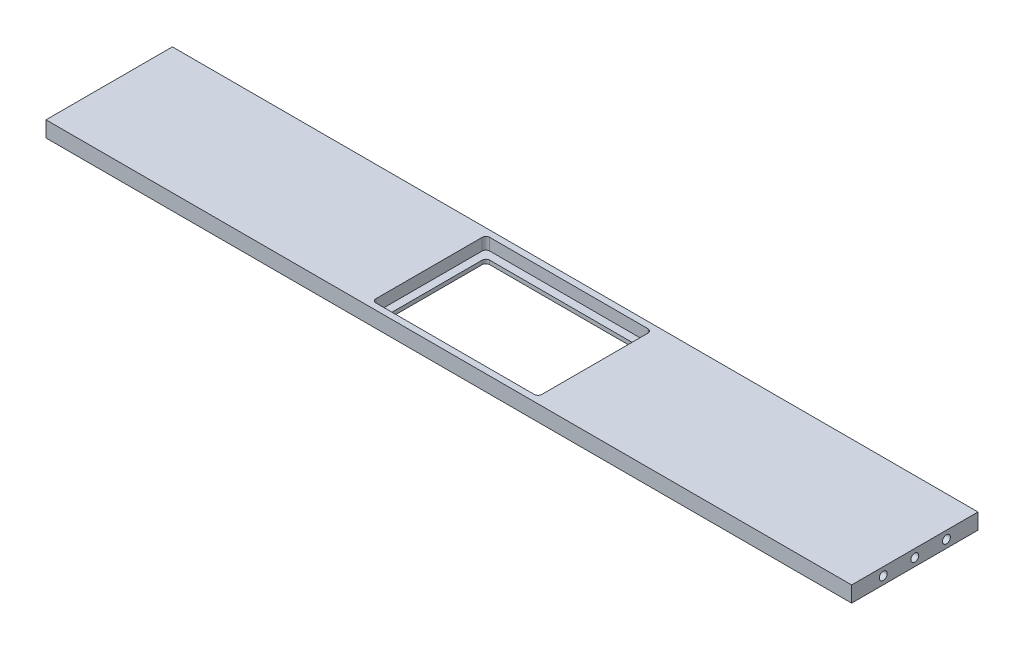
from build123d import *

# Parameters (mm, degrees)
SKETCH2_W                         = 647.7
SKETCH2_H                         = 12.7
BOSS_EXTRUDE1_DEPTH               = 50.8
CUT_EXTRUDE1_DEPTH                = 9.525
F_1_4_20_THREADED_HOLE_AT_2_COUNT = 2
F_1_4_20_THREADED_HOLE_AT_2_PITCH = 25.4
F_1_4_20_THREADED_HOLE_AT_3_COUNT = 2
F_1_4_20_THREADED_HOLE_AT_3_PITCH = 50.8
CUT_EXTRUDE2_DEPTH                = 329.056020368


with BuildPart() as part:
    # Sketch2 → Boss-Extrude1 (new, symmetric)
    with BuildSketch(Plane.XY):
        with Locations((0, -6.35)):
            Rectangle(SKETCH2_W, SKETCH2_H)
    extrude(amount=BOSS_EXTRUDE1_DEPTH, both=True)

    # Sketch3 → Cut-Extrude1 (cut)
    with BuildSketch(Plane(origin=(0, 0, 0), x_dir=(1, 0, 0), z_dir=(0, 1, 0))):
        with BuildLine():
            Line((63.675, 45.72), (-63.675, 45.72))
            ThreePointArc((-63.675, 45.72), (-65.796320344, 44.841320344), (-66.675, 42.72))
            Line((-66.675, 42.72), (-66.675, -42.72))
            ThreePointArc((-66.675, -42.72), (-65.796320344, -44.841320344), (-63.675, -45.72))
            Line((-63.675, -45.72), (63.675, -45.72))
            ThreePointArc((63.675, -45.72), (65.796320344, -44.841320344), (66.675, -42.72))
            Line((66.675, -42.72), (66.675, 42.72))
            ThreePointArc((66.675, 42.72), (65.796320344, 44.841320344), (63.675, 45.72))
        make_face()
    extrude(amount=-CUT_EXTRUDE1_DEPTH, mode=Mode.SUBTRACT)

    # Sketch6 → 1/4"-20 threaded hole (revolve, cut)
    with BuildSketch(Plane(origin=(-323.85, -6.35, -25.4), x_dir=(0, 0, 1), z_dir=(0, 1, 0))):
        Polygon((0, 0), (0, 52.707732465), (3.175, 50.8), (3.175, 0), align=None)
    f_1_4_20_threaded_hole = revolve(axis=Axis((-330.2, -6.35, -25.4), (1, 0, 0)), mode=Mode.SUBTRACT)

    # 1/4"-20 threaded hole at 2: 1/4"-20 threaded hole ×2
    with Locations(*[(0, 0, i * F_1_4_20_THREADED_HOLE_AT_2_PITCH) for i in range(1, F_1_4_20_THREADED_HOLE_AT_2_COUNT)]):
        add(f_1_4_20_threaded_hole, mode=Mode.SUBTRACT)

    # 1/4"-20 threaded hole at 3: 1/4"-20 threaded hole ×2
    with Locations(*[(0, 0, i * F_1_4_20_THREADED_HOLE_AT_3_PITCH) for i in range(1, F_1_4_20_THREADED_HOLE_AT_3_COUNT)]):
        add(f_1_4_20_threaded_hole, mode=Mode.SUBTRACT)

    # Mirror1: 1/4"-20 threaded hole across plane
    add(f_1_4_20_threaded_hole.mirror(Plane(origin=(0, 0, 0), x_dir=(0, 0, 1), z_dir=(1, 0, 0))), mode=Mode.SUBTRACT)

    # Mirror1 copy 1 sketch → Mirror1 copy 1 (revolve, cut)
    with BuildSketch(Plane(origin=(323.85, -6.35, 0), x_dir=(0, 0, 1), z_dir=(0, 1, 0))):
        Polygon((0, 0), (0, -52.707732465), (3.175, -50.8), (3.175, 0), align=None)
    revolve(axis=Axis((330.2, -6.35, 0), (1, 0, 0)), mode=Mode.SUBTRACT)

    # Mirror1 copy 2 sketch → Mirror1 copy 2 (revolve, cut)
    with BuildSketch(Plane(origin=(323.85, -6.35, 25.4), x_dir=(0, 0, 1), z_dir=(0, 1, 0))):
        Polygon((0, 0), (0, -52.707732465), (3.175, -50.8), (3.175, 0), align=None)
    revolve(axis=Axis((330.2, -6.35, 25.4), (1, 0, 0)), mode=Mode.SUBTRACT)

    # Sketch3<3> → Cut-Extrude2 (cut, through all)
    with BuildSketch(Plane(origin=(0, 0, 0), x_dir=(1, 0, 0), z_dir=(0, 1, 0))):
        with BuildLine():
            Line((57.325, 39.37), (-57.325, 39.37))
            ThreePointArc((-57.325, 39.37), (-59.446320344, 38.491320344), (-60.325, 36.37))
            Line((-60.325, 36.37), (-60.325, -36.37))
            ThreePointArc((-60.325, -36.37), (-59.446320344, -38.491320344), (-57.325, -39.37))
            Line((-57.325, -39.37), (57.325, -39.37))
            ThreePointArc((57.325, -39.37), (59.446320344, -38.491320344), (60.325, -36.37))
            Line((60.325, -36.37), (60.325, 36.37))
            ThreePointArc((60.325, 36.37), (59.446320344, 38.491320344), (57.325, 39.37))
        make_face()
    extrude(amount=-CUT_EXTRUDE2_DEPTH, mode=Mode.SUBTRACT)


solid = part.part
